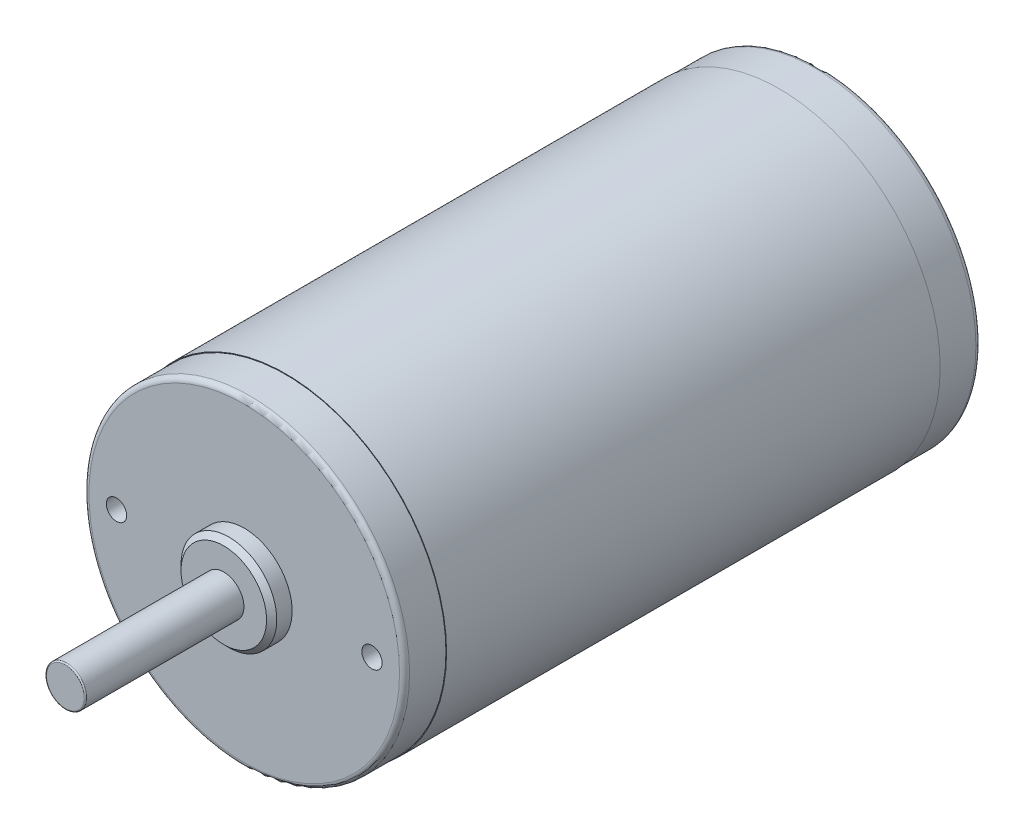
from build123d import *

# Parameters (mm, degrees)
SKETCH1_W           = 32.004
SKETCH1_H           = 98.1456
SKETCH2_R           = 31.877
BOSS_EXTRUDE1_DEPTH = 8.2296
SKETCH5_R           = 9.525
BOSS_EXTRUDE2_DEPTH = 4.572
SKETCH6_R           = 4
BOSS_EXTRUDE3_DEPTH = 31.5
BOSS_EXTRUDE4_START = 8.2296
SKETCH8_R           = 31.877
BOSS_EXTRUDE4_DEPTH = 8.2296
SKETCH9_R           = 15.0368
BOSS_EXTRUDE5_DEPTH = 4.7625
HOLE2_D             = 4.0386
HOLE2_DEPTH         = 13.6144
HOLE2_TIP           = 1.213317848
HOLE3_D             = 4.0386
HOLE3_DEPTH         = 13.6144
HOLE3_TIP           = 1.213317848
CHAMFER1_SIZE       = 1.015999998
CHAMFER1_SIZE2      = 1.016
FILLET1_R           = 0.254
FILLET2_R           = 1
FILLET3_R           = 1
FILLET4_R           = 1


with BuildPart() as part:
    # Sketch1 → Revolve1 (revolve)
    with BuildSketch(Plane.XZ.offset(-109.2962), mode=Mode.PRIVATE) as revolve1_sk:
        with Locations((51.562, -38.2524)):
            Rectangle(SKETCH1_W, SKETCH1_H)
    revolve(revolve1_sk.sketch.rotate(Axis((35.56, 109.2962, 10.8204), (0, 0, -1)), 180), axis=Axis((35.56, 109.2962, 10.8204), (0, 0, -1)))

    # Sketch2 → Boss-Extrude1 (add)
    with BuildSketch(Plane.XY.offset(10.8204)):
        with Locations((35.56, 109.2962)):
            Circle(SKETCH2_R)
    extrude(amount=BOSS_EXTRUDE1_DEPTH)

    # Sketch5 → Boss-Extrude2 (add)
    with BuildSketch(Plane(origin=(0, 0, 18.542), x_dir=(-1, 0, 0), z_dir=(0, 0, -1))):
        with Locations(Location((-35.56, 109.2962, 0), (0, 0, 180))):
            Circle(SKETCH5_R)
    extrude(amount=-BOSS_EXTRUDE2_DEPTH)

    # Sketch6 → Boss-Extrude3 (add)
    with BuildSketch(Plane.XY.offset(23.114)):
        with Locations((35.56, 109.2962)):
            Circle(SKETCH6_R)
    extrude(amount=BOSS_EXTRUDE3_DEPTH)

    # Sketch8 → Boss-Extrude4 (add)
    with BuildSketch(Plane(origin=(0, 0, -87.3252), x_dir=(-1, 0, 0), z_dir=(0, 0, -1)).offset(BOSS_EXTRUDE4_START)):
        with Locations(Location((-35.56, 109.2962, 0), (0, 0, 180))):
            Circle(SKETCH8_R)
    extrude(amount=-BOSS_EXTRUDE4_DEPTH)

    # Sketch9 → Boss-Extrude5 (add)
    with BuildSketch(Plane(origin=(0, 0, -95.5548), x_dir=(-1, 0, 0), z_dir=(0, 0, -1))):
        with Locations((-35.56, 109.2962)):
            Circle(SKETCH9_R)
    extrude(amount=BOSS_EXTRUDE5_DEPTH)

    # Hole2
    with Locations(Plane.XY.offset(19.05)):
        with Locations((60.96, 109.2962)):
            Hole(HOLE2_D / 2, depth=HOLE2_DEPTH)
            with Locations((0, 0, -(HOLE2_DEPTH + HOLE2_TIP / 2))):  # 118° drill point
                Cone(0, HOLE2_D / 2, HOLE2_TIP, mode=Mode.SUBTRACT)

    # Hole3
    with Locations(Plane.XY.offset(19.05)):
        with Locations((10.16, 109.2962)):
            Hole(HOLE3_D / 2, depth=HOLE3_DEPTH)
            with Locations((0, 0, -(HOLE3_DEPTH + HOLE3_TIP / 2))):  # 118° drill point
                Cone(0, HOLE3_D / 2, HOLE3_TIP, mode=Mode.SUBTRACT)

    # Chamfer1
    chamfer1_edges = [part.edges().sort_by_distance(p)[0] for p in [
        (26.035, 109.2962, 23.114),
    ]]
    chamfer1_side = [part.faces().sort_by_distance(p)[0] for p in [
        (26.035, 109.2962, 21.082),
    ]]
    chamfer(chamfer1_edges, length=CHAMFER1_SIZE, length2=CHAMFER1_SIZE2, reference=chamfer1_side[0])

    # Fillet1
    fillet1_edges = [part.edges().sort_by_distance(p)[0] for p in [
        (31.56, 109.2962, 54.614),
    ]]
    fillet(fillet1_edges, radius=FILLET1_R)

    # Fillet2
    fillet2_edges = [part.edges().sort_by_distance(p)[0] for p in [
        (3.683, 109.2962, -95.5548),
    ]]
    fillet(fillet2_edges, radius=FILLET2_R)

    # Fillet3
    fillet3_edges = [part.edges().sort_by_distance(p)[0] for p in [
        (3.683, 109.2962, 19.05),
    ]]
    fillet(fillet3_edges, radius=FILLET3_R)

    # Fillet4
    fillet4_edges = [part.edges().sort_by_distance(p)[0] for p in [
        (50.5968, 109.2962, -100.3173),
    ]]
    fillet(fillet4_edges, radius=FILLET4_R)


solid = part.part
